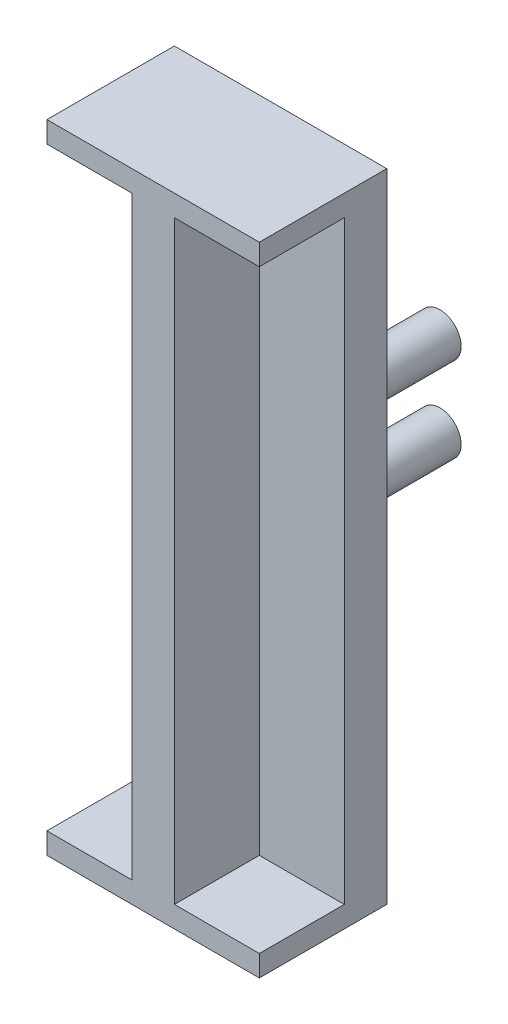
from build123d import *

# Parameters (mm, degrees)
SKETCH1_W           = 10
SKETCH1_H           = 30
BOSS_EXTRUDE1_DEPTH = 2
BOSS_EXTRUDE2_DEPTH = 4
SKETCH4_R           = 1
BOSS_EXTRUDE3_DEPTH = 7.5


with BuildPart() as part:
    # Sketch1 → Boss-Extrude1 (new body)
    with BuildSketch(Plane.XY):
        Rectangle(SKETCH1_W, SKETCH1_H)
    extrude(amount=BOSS_EXTRUDE1_DEPTH)

    # Sketch2 → Boss-Extrude2 (add)
    with BuildSketch(Plane.XY.offset(2)):
        Polygon((1, 14), (1, -14), (5, -14), (5, -15), (-5, -15), (-5, -14), (-1, -14), (-1, 14), (-5, 14), (-5, 15), (5, 15), (5, 14), align=None)
    extrude(amount=BOSS_EXTRUDE2_DEPTH)

    # Sketch4 → Boss-Extrude3 (add)
    with BuildSketch(Plane(origin=(0, 0, 0), x_dir=(-1, 0, 0), z_dir=(0, 0, -1))):
        with Locations((0, 2)):
            Circle(SKETCH4_R)
        with Locations((0, -2)):
            Circle(SKETCH4_R)
    extrude(amount=BOSS_EXTRUDE3_DEPTH)


solid = part.part
